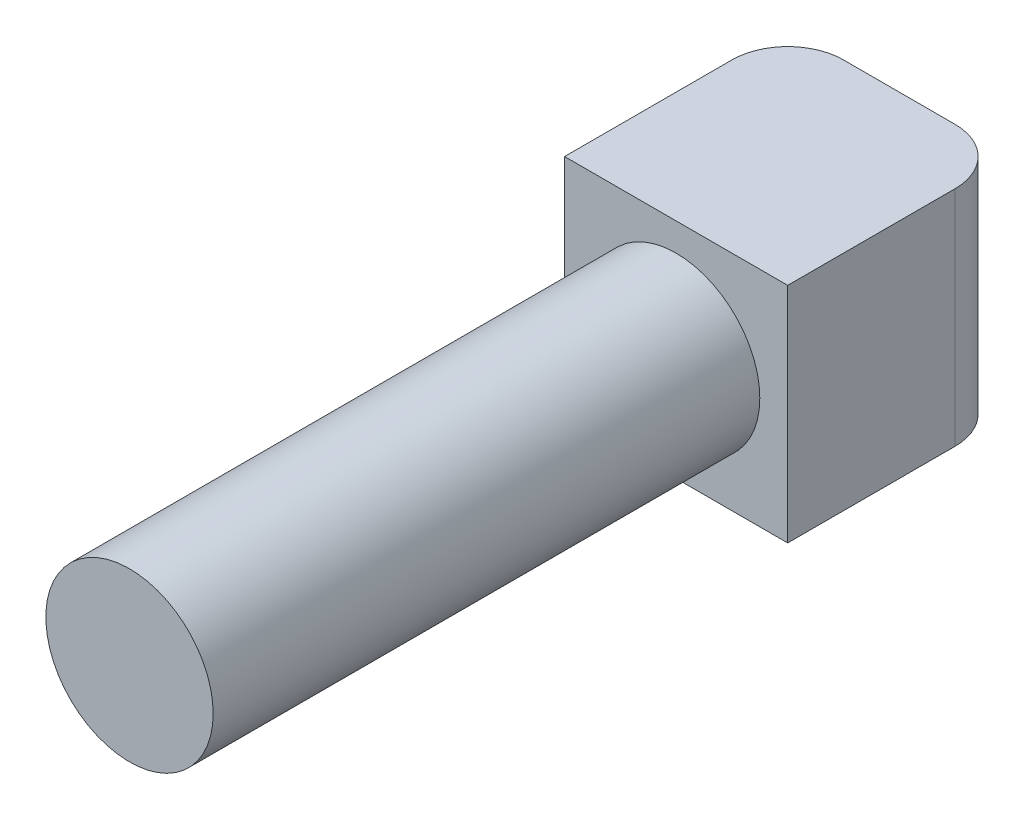
from build123d import *

# Parameters (mm, degrees)
SKETCH2_W           = 4
SKETCH2_H           = 4
BOSS_EXTRUDE1_DEPTH = 4
FILLET1_R           = 1
SKETCH3_R           = 1.5
BOSS_EXTRUDE2_DEPTH = 9.8


with BuildPart() as part:
    # Sketch2 → Boss-Extrude1 (new body)
    with BuildSketch(Plane(origin=(0, 0, 0), x_dir=(0, 0, -1), z_dir=(1, 0, 0))):
        with Locations((2, 2)):
            Rectangle(SKETCH2_W, SKETCH2_H)
    extrude(amount=BOSS_EXTRUDE1_DEPTH)

    # Fillet1
    fillet1_edges = [part.edges().sort_by_distance(p)[0] for p in [
        (4, 2, -4),
        (0, 2, -4),
    ]]
    fillet(fillet1_edges, radius=FILLET1_R)

    # Sketch3 → Boss-Extrude2 (add)
    with BuildSketch(Plane.XY):
        with Locations((2, 2)):
            Circle(SKETCH3_R)
    extrude(amount=BOSS_EXTRUDE2_DEPTH)


solid = part.part
